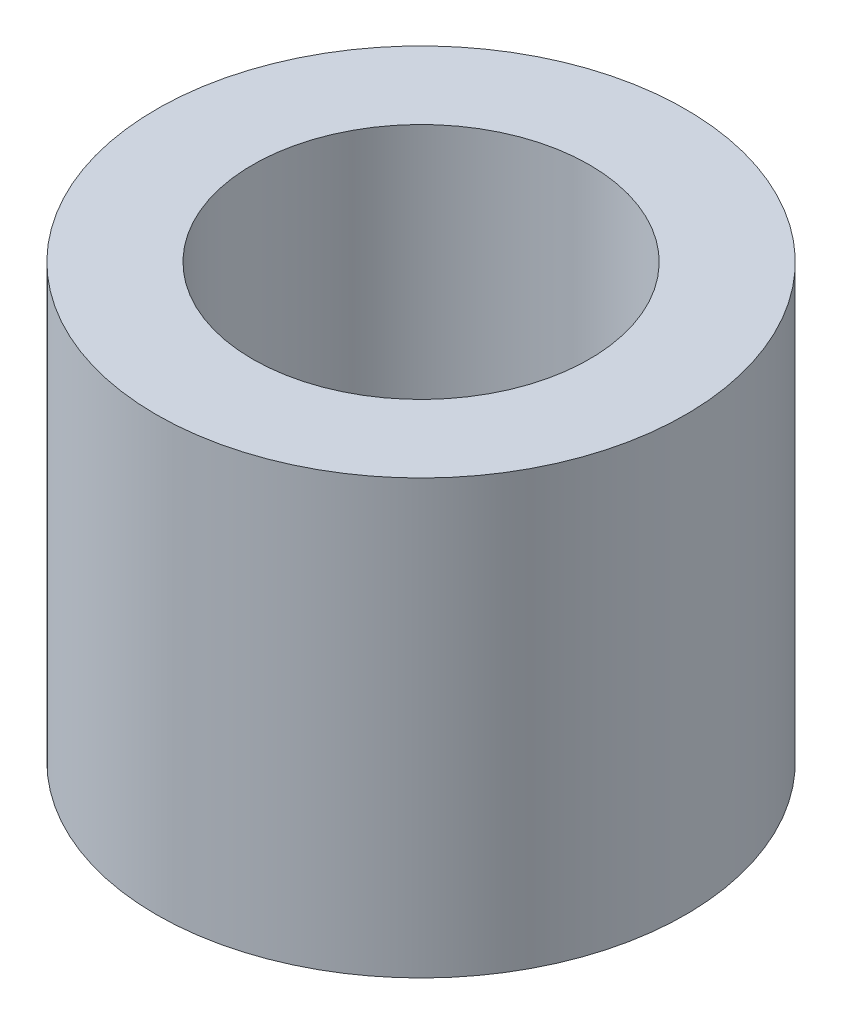
from build123d import *

# Parameters (mm, degrees)
SKETCH_1_R      = 2.75
SKETCH_1_R_2    = 1.75
EXTRUDE_1_DEPTH = 4.5


with BuildPart() as part:
    # 草图1 → 凸台-拉伸1 (new body)
    with BuildSketch(Plane(origin=(0, 0, 0), x_dir=(1, 0, 0), z_dir=(0, 1, 0))):
        with Locations(Location((0, 0, 0), (0, 0, 270))):
            Circle(SKETCH_1_R)
        with Locations(Location((0, 0, 0), (0, 0, 270))):
            Circle(SKETCH_1_R_2, mode=Mode.SUBTRACT)
    extrude(amount=EXTRUDE_1_DEPTH)


solid = part.part
